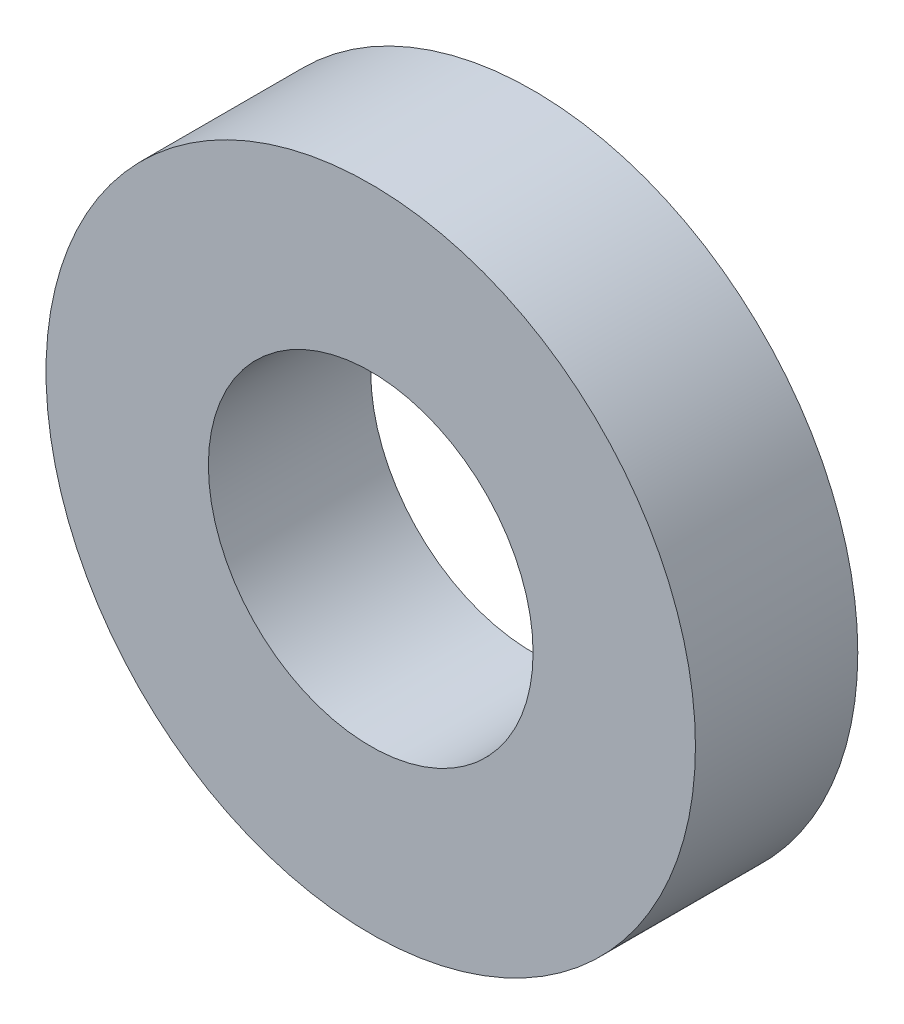
from build123d import *

# Parameters (mm, degrees)
SKETCH_1_R      = 8
SKETCH_1_R_2    = 4
EXTRUDE_1_DEPTH = 4


with BuildPart() as part:
    # 草图1 → 凸台-拉伸1 (new body)
    with BuildSketch(Plane.XY):
        Circle(SKETCH_1_R)
        Circle(SKETCH_1_R_2, mode=Mode.SUBTRACT)
    extrude(amount=EXTRUDE_1_DEPTH)


solid = part.part
